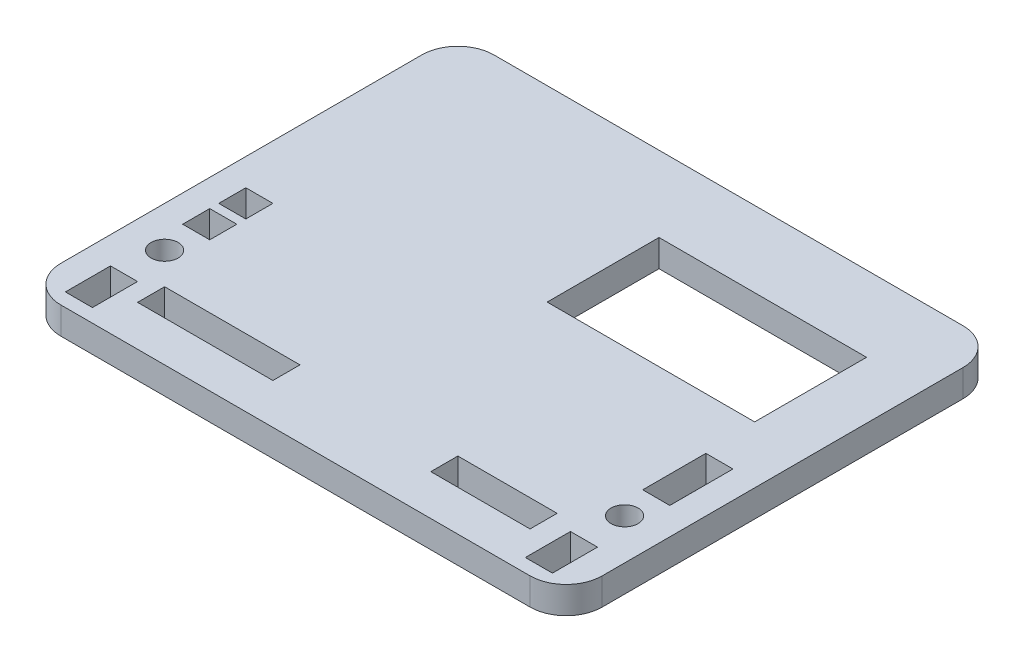
from build123d import *

# Parameters (mm, degrees)
CROQUIS1_R                 = 1.5
CROQUIS1_W                 = 15
CROQUIS1_H                 = 3
CROQUIS1_W_2               = 3.003677296
CROQUIS1_H_2               = 7.000000001
CROQUIS1_W_3               = 23
CROQUIS1_H_3               = 12.400000001
SALIENTE_EXTRUIR1_DEPTH    = 3
S_LIDO_MOVER_COPIAR2_ANGLE = 90


with BuildPart() as part:
    # Croquis1 → Saliente-Extruir1 (new body)
    with BuildSketch(Plane(origin=(0, 0, 0), x_dir=(-1, 0, 0), z_dir=(0, 0, 1))):
        with BuildLine():
            Line((41781.908830987, 309.199124202), (41833.908830987, 309.199124202))
            ThreePointArc((41833.908830987, 309.199124202), (41836.737258112, 310.370697077), (41837.908830987, 313.199124202))
            Line((41837.908830987, 313.199124202), (41837.908830987, 353.199124202))
            ThreePointArc((41837.908830987, 353.199124202), (41836.737258112, 356.027551327), (41833.908830987, 357.199124202))
            Line((41833.908830987, 357.199124202), (41781.908830987, 357.199124202))
            ThreePointArc((41781.908830987, 357.199124202), (41779.080403863, 356.027551327), (41777.908830987, 353.199124202))
            Line((41777.908830987, 353.199124202), (41777.908830987, 313.199124202))
            ThreePointArc((41777.908830987, 313.199124202), (41779.080403863, 310.370697077), (41781.908830987, 309.199124202))
        make_face()
        with Locations(Location((41833.408830987, 320.199124198, 0), (0, 0, 180))):
            Circle(CROQUIS1_R, mode=Mode.SUBTRACT)
        with Locations(Location((41782.429915347, 320.197748539, 0), (0, 0, 180))):
            Circle(CROQUIS1_R, mode=Mode.SUBTRACT)
        Polygon((41786.408830987, 313.699124203), (41796.408830987, 313.699124203), (41797.408830987, 313.699124203), (41797.408830987, 316.699124203), (41796.408830987, 316.699124203), (41786.408830987, 316.699124203), align=None, mode=Mode.SUBTRACT)
        Polygon((41780.927290538, 315.695638799), (41783.429912384, 315.695638799), (41783.927165547, 315.695638799), (41783.929915347, 310.699124202), (41780.929915347, 310.699124202), align=None, mode=Mode.SUBTRACT)
        Polygon((41831.908830987, 310.699124202), (41834.408830987, 310.699124202), (41834.908830987, 310.699124202), (41834.908830987, 315.699124202), (41834.408830987, 315.699124202), (41831.908830987, 315.699124202), align=None, mode=Mode.SUBTRACT)
        Polygon((41831.908830987, 323.699124202), (41834.408830987, 323.699124202), (41834.908830987, 323.699124202), (41834.908830987, 326.699124202), (41834.408830987, 326.699124202), (41831.908830987, 326.699124202), align=None, mode=Mode.SUBTRACT)
        Polygon((41831.908830987, 327.699124202), (41834.408830987, 327.699124202), (41834.908830987, 327.699124202), (41834.908830987, 330.699124202), (41834.408830987, 330.699124202), (41831.908830987, 330.699124202), align=None, mode=Mode.SUBTRACT)
        with Locations((41822.408830987, 315.199124203)):
            Rectangle(CROQUIS1_W, CROQUIS1_H, mode=Mode.SUBTRACT)
        with Locations((41782.421247435, 327.199124203)):
            Rectangle(CROQUIS1_W_2, CROQUIS1_H_2, mode=Mode.SUBTRACT)
        with Locations((41795.738219532, 342.622009866)):
            Rectangle(CROQUIS1_W_3, CROQUIS1_H_3, mode=Mode.SUBTRACT)
    extrude(amount=SALIENTE_EXTRUIR1_DEPTH)


with BuildPart() as part_1:
    # Sólido-Mover/Copiar2: moved
    add(part.part.rotate(Axis((0, -333.199124202, 1.5), (1, 0, 0)), S_LIDO_MOVER_COPIAR2_ANGLE))


solid = part_1.part
